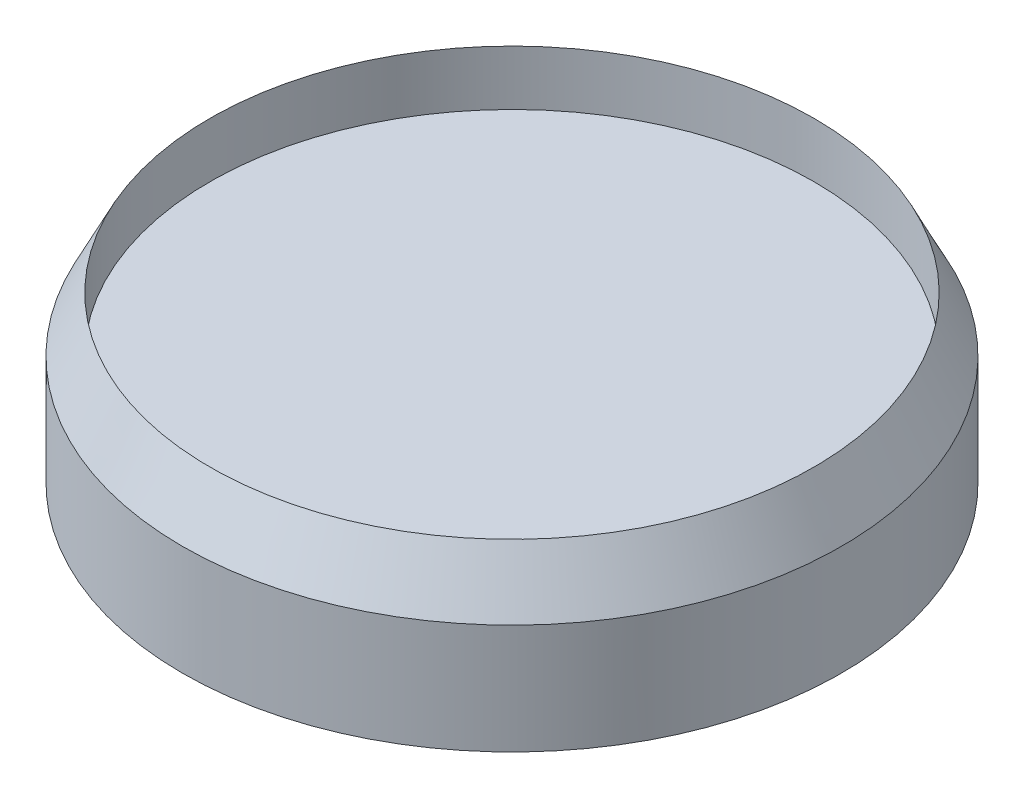
from build123d import *

# Parameters (mm, degrees)
SKETCH1_R           = 30
BOSS_EXTRUDE1_DEPTH = 10


with BuildPart() as part:
    # Sketch1 → Boss-Extrude1 (new body)
    with BuildSketch(Plane(origin=(0, 0, 0), x_dir=(1, 0, 0), z_dir=(0, 1, 0))):
        with Locations(Location((0, 0, 0), (0, 0, 270))):
            Circle(SKETCH1_R)
    extrude(amount=BOSS_EXTRUDE1_DEPTH)

    # Sketch3 → Revolve1 (revolve)
    with BuildSketch(Plane.XY, mode=Mode.PRIVATE) as revolve1_sk:
        Polygon((-27.5, 10), (-27.5, 15), (-30, 10), align=None)
    revolve(revolve1_sk.sketch.rotate(Axis((0, 10, 0), (0, 1, 0)), 270), axis=Axis((0, 10, 0), (0, 1, 0)))


solid = part.part
